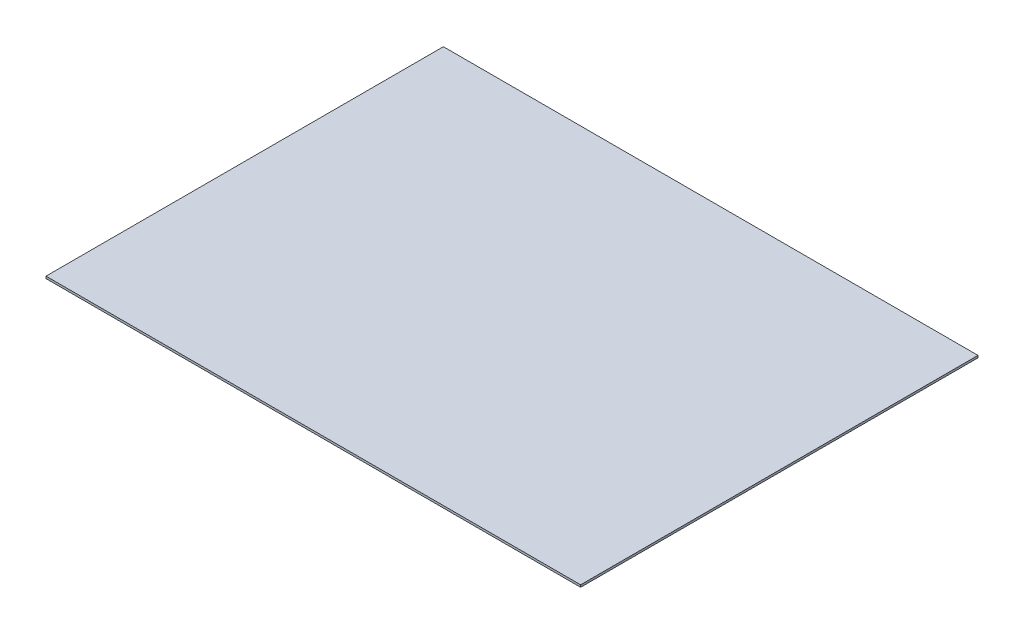
from build123d import *

# Parameters (mm, degrees)
SKETCH1_W           = 625.478292153
SKETCH1_H           = 464.907745511
BOSS_EXTRUDE1_DEPTH = 2.54


with BuildPart() as part:
    # Sketch1 → Boss-Extrude1 (new body)
    with BuildSketch(Plane(origin=(0, 0, 0), x_dir=(1, 0, 0), z_dir=(0, 1, 0))):
        with Locations((79.351723631, -41.07618635)):
            Rectangle(SKETCH1_W, SKETCH1_H)
    extrude(amount=BOSS_EXTRUDE1_DEPTH)


solid = part.part
